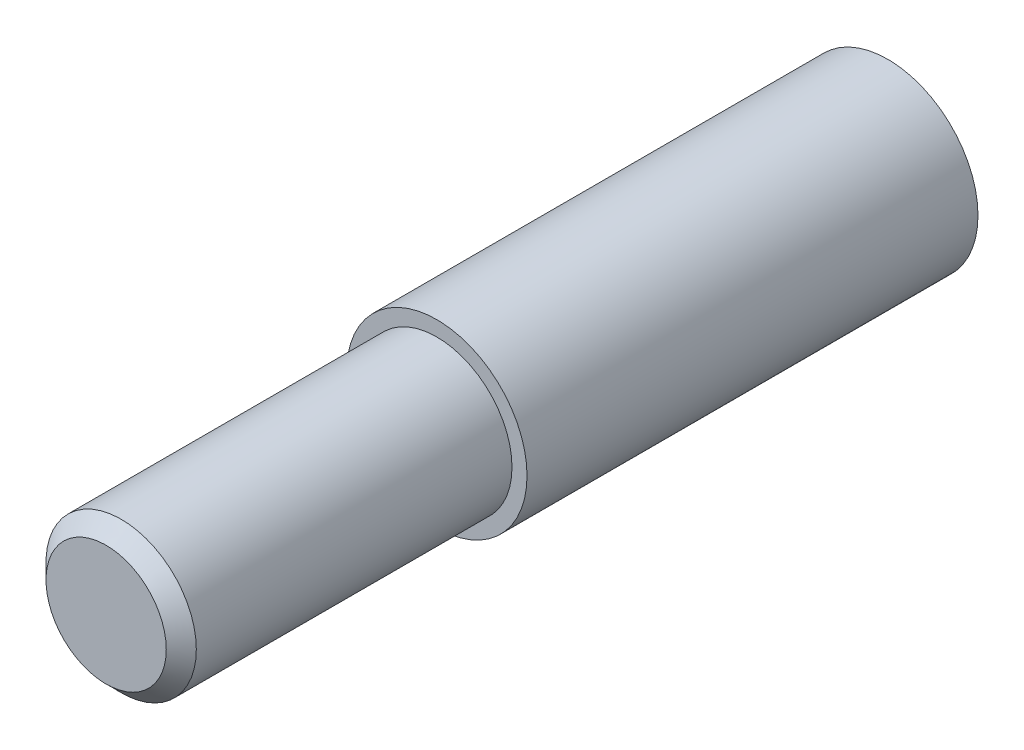
from build123d import *

# Parameters (mm, degrees)
CROQUIS1_R              = 6
SALIENTE_EXTRUIR1_DEPTH = 30
CROQUIS2_R              = 5
SALIENTE_EXTRUIR2_DEPTH = 22
CHAFL_N1_SIZE           = 1


with BuildPart() as part:
    # Croquis1 → Saliente-Extruir1 (new body)
    with BuildSketch(Plane.XY):
        Circle(CROQUIS1_R)
    extrude(amount=SALIENTE_EXTRUIR1_DEPTH)

    # Croquis2 → Saliente-Extruir2 (add)
    with BuildSketch(Plane.XY.offset(30)):
        Circle(CROQUIS2_R)
    extrude(amount=SALIENTE_EXTRUIR2_DEPTH)

    # Chaflán1
    chafl_n1_edges = [part.edges().sort_by_distance(p)[0] for p in [
        (-5, 0, 52),
    ]]
    chamfer(chafl_n1_edges, length=CHAFL_N1_SIZE)


solid = part.part
